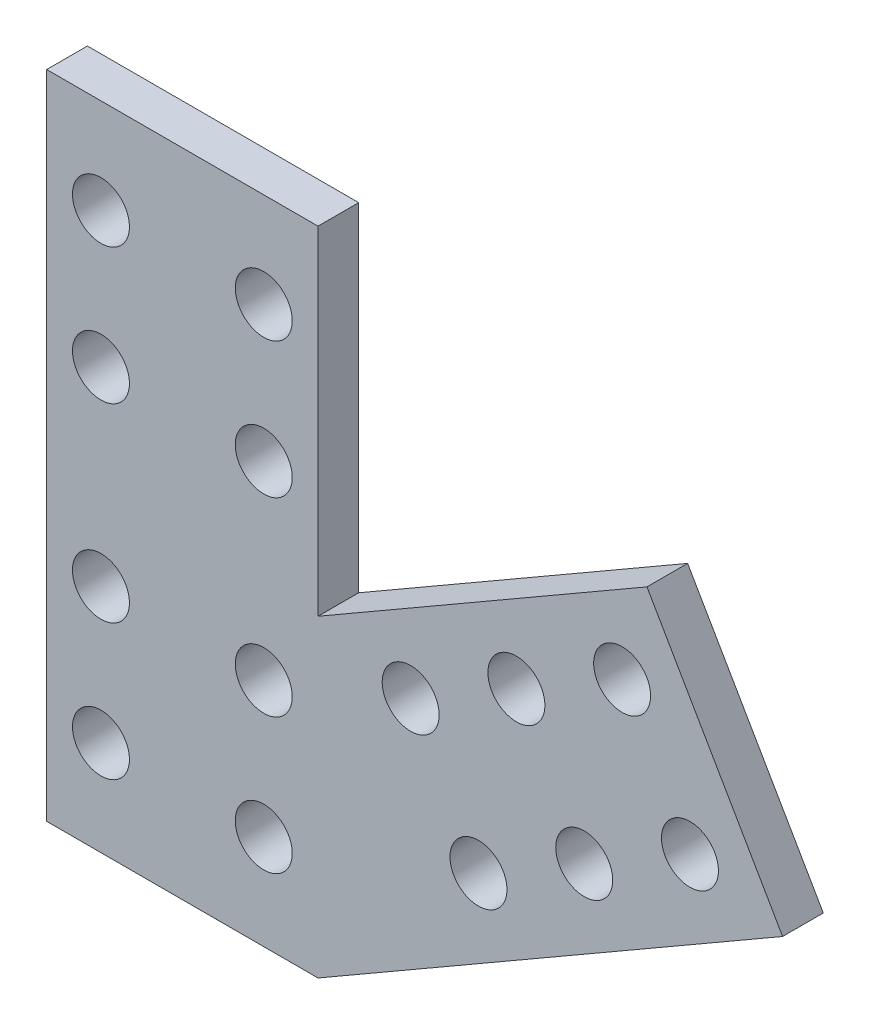
from build123d import *

# Parameters (mm, degrees)
EXTRUDE_1_DEPTH     = 3
SKETCH_2_R          = 2.1
CUT_EXTRUDE_1_DEPTH = 3


with BuildPart() as part:
    # 草图1 → 凸台-拉伸1 (new body)
    with BuildSketch(Plane.XY):
        Polygon((0, 48), (0, 0), (20, 0), (54.248711306, 19.773502692), (44.248711306, 37.094010768), (20, 23.094010768), (20, 48), align=None)
    extrude(amount=EXTRUDE_1_DEPTH)

    # 草图2 → 切除-拉伸1 (cut)
    with BuildSketch(Plane(origin=(0, 0, 0), x_dir=(-1, 0, 0), z_dir=(0, 0, -1))):
        with Locations((-47.418584287, 21.603629711)):
            Circle(SKETCH_2_R)
        with Locations((-42.418584287, 30.263883749)):
            Circle(SKETCH_2_R)
        with Locations((-34.624355653, 25.763883749)):
            Circle(SKETCH_2_R)
        with Locations((-39.624355653, 17.103629711)):
            Circle(SKETCH_2_R)
        with Locations((-31.830127019, 12.603629711)):
            Circle(SKETCH_2_R)
        with Locations((-26.830127019, 21.263883749)):
            Circle(SKETCH_2_R)
        with Locations((-16, 7)):
            Circle(SKETCH_2_R)
        with Locations((-16, 17)):
            Circle(SKETCH_2_R)
        with Locations((-4, 7)):
            Circle(SKETCH_2_R)
        with Locations((-4, 17)):
            Circle(SKETCH_2_R)
        with Locations((-16, 31)):
            Circle(SKETCH_2_R)
        with Locations((-16, 41)):
            Circle(SKETCH_2_R)
        with Locations((-4, 31)):
            Circle(SKETCH_2_R)
        with Locations((-4, 41)):
            Circle(SKETCH_2_R)
    extrude(amount=-CUT_EXTRUDE_1_DEPTH, mode=Mode.SUBTRACT)


solid = part.part
